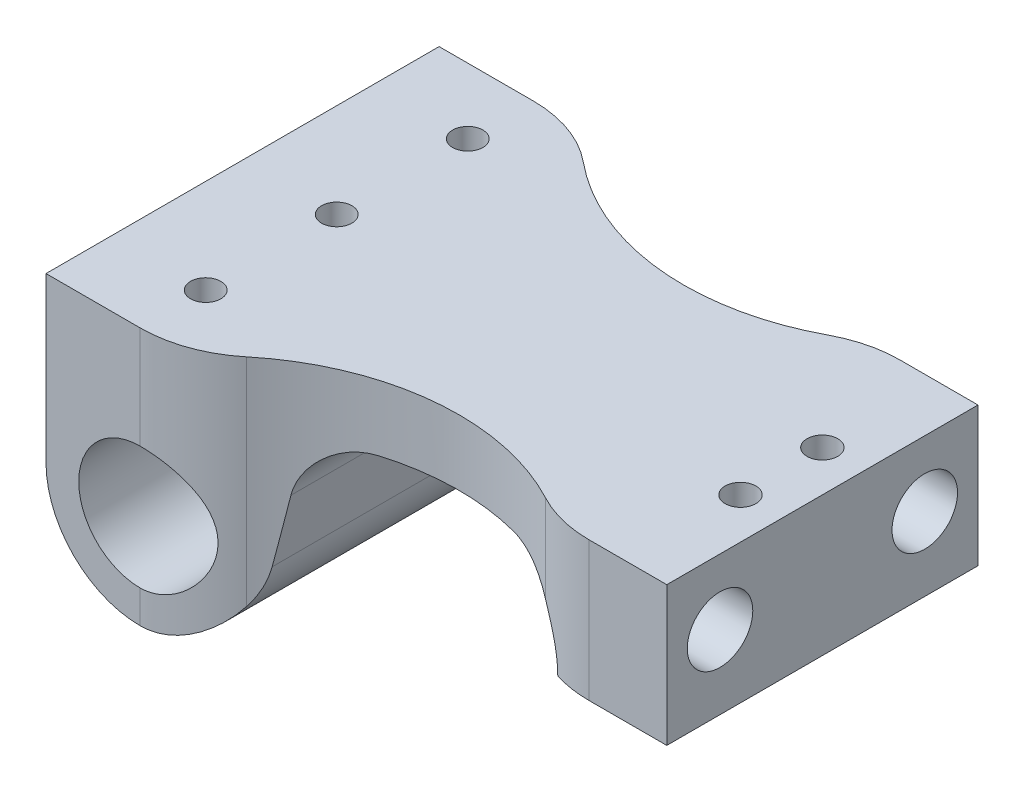
from build123d import *

# Parameters (mm, degrees)
SKETCH1_R               = 7.5
BOSS_EXTRUDE1_DEPTH     = 24
SKETCH2_R               = 4
CUT_EXTRUDE1_DEPTH      = 5
CUT_EXTRUDE2_DEPTH      = 57.500796455
CUT_EXTRUDE2_DEPTH_BACK = 57.500796455
BOSS_EXTRUDE2_START     = 5.5
SKETCH4_W               = 38
SKETCH4_H               = 17
SKETCH4_R               = 4
BOSS_EXTRUDE2_DEPTH     = 5.5
CUT_EXTRUDE3_DEPTH      = 57.500796624
CUT_EXTRUDE3_DEPTH_BACK = 57.500796624
SKETCH5_R               = 1.875
SKETCH6_R               = 1.85
CUT_EXTRUDE4_DEPTH      = 9


with BuildPart() as part:
    # Sketch1 → Boss-Extrude1 (new, symmetric)
    with BuildSketch(Plane.XY):
        with BuildLine():
            Line((-17.47471084, 5.003045957), (-16.099481109, 12.802361333))
            ThreePointArc((-16.099481109, 12.802361333), (-13.534330034, 17.245333323), (-8.713422961, 19))
            Line((-8.713422961, 19), (7.5, 19))
            ThreePointArc((7.5, 19), (13.863961031, 16.363961031), (16.5, 10))
            Line((16.5, 10), (25, 10))
            Line((25, 10), (25, 27))
            Line((25, 27), (12.627503281, 27))
            Line((12.627503281, 27), (-40.3, 27))
            Line((-40.3, 27), (-40.3, 7))
            ThreePointArc((-40.3, 7), (-29.802291042, -4.456239028), (-17.47471084, 5.003045957))
        make_face()
        with Locations((-28.8, 7)):
            Circle(SKETCH1_R, mode=Mode.SUBTRACT)
    extrude(amount=BOSS_EXTRUDE1_DEPTH, both=True)

    # Sketch2 → Cut-Extrude1 (cut)
    with BuildSketch(Plane(origin=(25, 0, 0), x_dir=(0, 0, -1), z_dir=(1, 0, 0))):
        with Locations((-12.5, 19)):
            Circle(SKETCH2_R)
        with Locations((12.5, 19)):
            Circle(SKETCH2_R)
    extrude(amount=-CUT_EXTRUDE1_DEPTH, mode=Mode.SUBTRACT)

    # Sketch3 → Cut-Extrude2 (cut, two sides: drawn at the far end of the back side and taken through both)
    with BuildSketch(Plane(origin=(0, 27, 0), x_dir=(1, 0, 0), z_dir=(0, 1, 0)).offset(-CUT_EXTRUDE2_DEPTH_BACK)):
        with BuildLine():
            Line((-28.8, -24), (25, -24))
            Line((25, -24), (25, -19))
            Line((25, -19), (21, -19))
            ThreePointArc((21, -19), (17.364289008, -18.552718151), (13.94540302, -17.237547411))
            ThreePointArc((13.94540302, -17.237547411), (-3.160771505, -13.862715808), (-19.25459698, -20.570880744))
            ThreePointArc((-19.25459698, -20.570880744), (-23.728669364, -23.116713696), (-28.8, -24))
        make_face()
        with BuildLine():
            Line((21, 19), (25, 19))
            Line((25, 19), (25, 24))
            Line((25, 24), (-28.8, 24))
            ThreePointArc((-28.8, 24), (-23.728669364, 23.116713696), (-19.25459698, 20.570880744))
            ThreePointArc((-19.25459698, 20.570880744), (-3.160771505, 13.862715808), (13.94540302, 17.237547411))
            ThreePointArc((13.94540302, 17.237547411), (17.364289008, 18.552718151), (21, 19))
        make_face()
    extrude(amount=CUT_EXTRUDE2_DEPTH + CUT_EXTRUDE2_DEPTH_BACK, mode=Mode.SUBTRACT)

    # Sketch4 → Boss-Extrude2 (add)
    with BuildSketch(Plane(origin=(25, 0, 0), x_dir=(0, 0, -1), z_dir=(1, 0, 0)).offset(BOSS_EXTRUDE2_START)):
        with Locations((0, 18.5)):
            Rectangle(SKETCH4_W, SKETCH4_H)
        with Locations((12.5, 19)):
            Circle(SKETCH4_R, mode=Mode.SUBTRACT)
        with Locations((-12.5, 19)):
            Circle(SKETCH4_R, mode=Mode.SUBTRACT)
    extrude(amount=-BOSS_EXTRUDE2_DEPTH)

    # Sketch5 → Cut-Extrude3 (cut, two sides: drawn at the far end of the back side and taken through both)
    with BuildSketch(Plane(origin=(0, 27, 0), x_dir=(1, 0, 0), z_dir=(0, 1, 0)).offset(-CUT_EXTRUDE3_DEPTH_BACK)):
        with Locations(Location((25.5, -5, 0), (0, 0, 180))):
            Circle(SKETCH5_R)
        with Locations(Location((25.5, 5, 0), (0, 0, 180))):
            Circle(SKETCH5_R)
    extrude(amount=CUT_EXTRUDE3_DEPTH + CUT_EXTRUDE3_DEPTH_BACK, mode=Mode.SUBTRACT)

    # Sketch6 → Cut-Extrude4 (cut)
    with BuildSketch(Plane(origin=(0, 27, 0), x_dir=(1, 0, 0), z_dir=(0, 1, 0))):
        with Locations(Location((-28.8, 16, 0), (0, 0, 270))):
            Circle(SKETCH6_R)
        with Locations(Location((-28.8, 0, 0), (0, 0, 270))):
            Circle(SKETCH6_R)
        with Locations(Location((-28.8, -16, 0), (0, 0, 270))):
            Circle(SKETCH6_R)
    extrude(amount=-CUT_EXTRUDE4_DEPTH, mode=Mode.SUBTRACT)


solid = part.part
